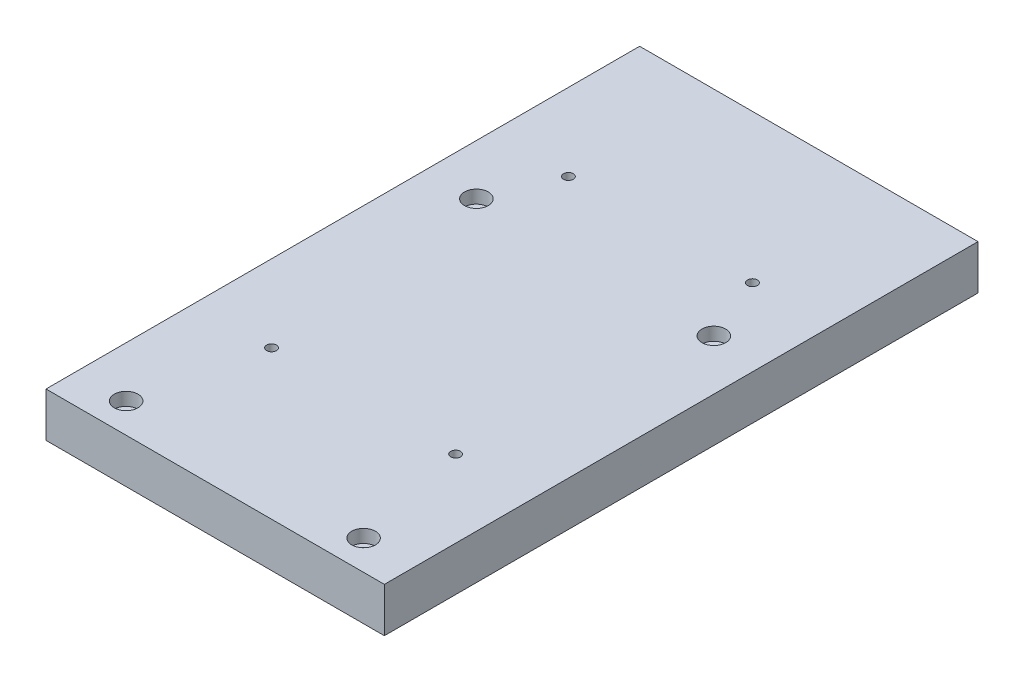
from build123d import *

# Parameters (mm, degrees)
SKETCH_1_W                   = 114
SKETCH_1_H                   = 200
EXTRUDE_1_DEPTH              = 15
HOLE_WIZARD_M4_1_D           = 4.5
HOLE_WIZARD_M4_1_CBORE_D     = 8
HOLE_WIZARD_M4_1_CBORE_DEPTH = 4.4
PATTERN_LINEAR_1_COUNT       = 2
PATTERN_LINEAR_1_PITCH       = 118
PATTERN_LINEAR_1_COUNT_DIR2  = 2
PATTERN_LINEAR_1_PITCH_DIR2  = 80
PATTERN_LINEAR_3_COUNT       = 2
PATTERN_LINEAR_3_PITCH       = 100
PATTERN_LINEAR_3_COUNT_DIR2  = 2
PATTERN_LINEAR_3_PITCH_DIR2  = 62


with BuildPart() as part:
    # 草图1 → 凸台-拉伸1 (new body)
    with BuildSketch(Plane(origin=(0, 0, 0), x_dir=(1, 0, 0), z_dir=(0, 1, 0))):
        Rectangle(SKETCH_1_W, SKETCH_1_H)
    extrude(amount=EXTRUDE_1_DEPTH)

    # Hole Wizard M4 _1 (through all)
    with Locations(Plane(origin=(0, 15, 0), x_dir=(1, 0, 0), z_dir=(0, 1, 0))):
        with Locations((-40, -90)):
            hole_wizard_m4_1 = CounterBoreHole(HOLE_WIZARD_M4_1_D / 2, HOLE_WIZARD_M4_1_CBORE_D / 2, HOLE_WIZARD_M4_1_CBORE_DEPTH)

    # 阵列(线性)1: Hole Wizard M4 _1 2 × 2
    with Locations(*[(j * PATTERN_LINEAR_1_PITCH_DIR2, 0, -i * PATTERN_LINEAR_1_PITCH) for i in range(PATTERN_LINEAR_1_COUNT) for j in range(PATTERN_LINEAR_1_COUNT_DIR2) if (i, j) != (0, 0)]):
        add(hole_wizard_m4_1, mode=Mode.SUBTRACT)

    # 草图6 → Hole Wizard M4 _1 2 (revolve, cut)
    with BuildSketch(Plane(origin=(-31, 15, 50), x_dir=(0, 0, 1), z_dir=(1, 0, 0))):
        Polygon((0, 0), (0, 11.091420021), (1.65, 10.1), (1.65, 0), align=None)
    hole_wizard_m4_1_2 = revolve(axis=Axis((-31, 21.35, 50), (0, -1, 0)), mode=Mode.SUBTRACT)

    # 阵列(线性)3: Hole Wizard M4 _1 2 2 × 2
    with Locations(*[(j * PATTERN_LINEAR_3_PITCH_DIR2, 0, -i * PATTERN_LINEAR_3_PITCH) for i in range(PATTERN_LINEAR_3_COUNT) for j in range(PATTERN_LINEAR_3_COUNT_DIR2) if (i, j) != (0, 0)]):
        add(hole_wizard_m4_1_2, mode=Mode.SUBTRACT)


solid = part.part
